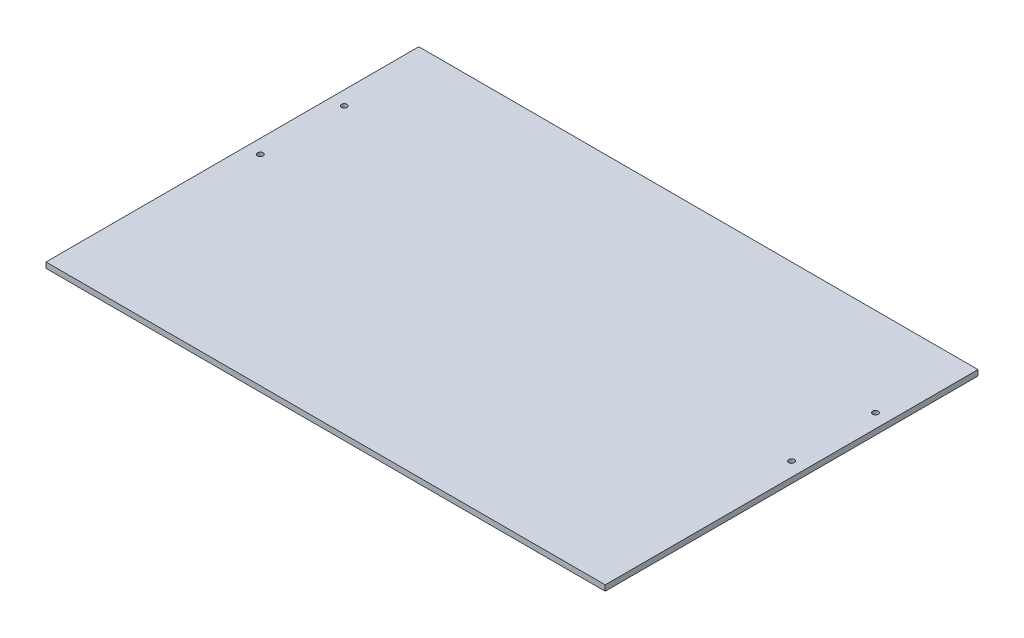
from build123d import *

# Parameters (mm, degrees)
ESBO_O1_W                = 300
ESBO_O1_H                = 200
ESBO_O1_R                = 1.5
RESSALTO_EXTRUS_O1_DEPTH = 3


with BuildPart() as part:
    # Esboço1 → Ressalto-extrusão1 (new body)
    with BuildSketch(Plane(origin=(0, 0, 0), x_dir=(1, 0, 0), z_dir=(0, 1, 0))):
        Rectangle(ESBO_O1_W, ESBO_O1_H)
        with Locations(Location((-142.5, 52.5, 0), (0, 0, 270))):
            Circle(ESBO_O1_R, mode=Mode.SUBTRACT)
        with Locations(Location((-142.5, 7.5, 0), (0, 0, 270))):
            Circle(ESBO_O1_R, mode=Mode.SUBTRACT)
        with Locations(Location((142.5, 7.5, 0), (0, 0, 90))):
            Circle(ESBO_O1_R, mode=Mode.SUBTRACT)
        with Locations(Location((142.5, 52.5, 0), (0, 0, 90))):
            Circle(ESBO_O1_R, mode=Mode.SUBTRACT)
    extrude(amount=RESSALTO_EXTRUS_O1_DEPTH)


solid = part.part
